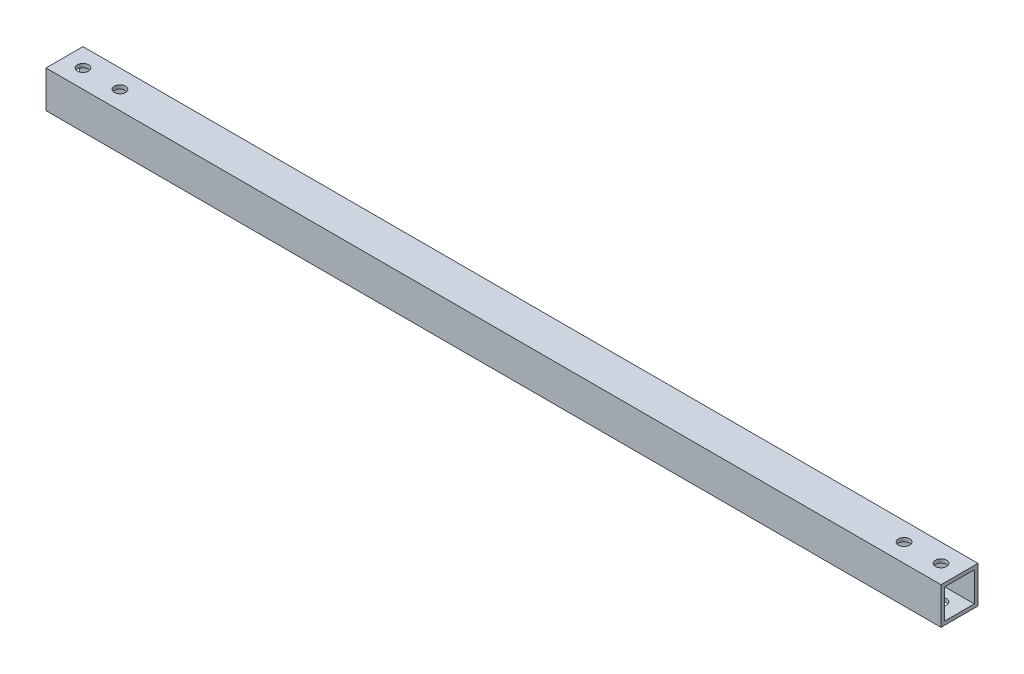
from build123d import *

# Parameters (mm, degrees)
SKETCH1_W           = 20
SKETCH1_H           = 20
SKETCH1_W_2         = 16
SKETCH1_H_2         = 16
BOSS_EXTRUDE1_DEPTH = 242
SKETCH2_R           = 3
CUT_EXTRUDE1_DEPTH  = 244.030862238


with BuildPart() as part:
    # Sketch1 → Boss-Extrude1 (new, symmetric)
    with BuildSketch(Plane(origin=(0, 0, 0), x_dir=(0, 0, -1), z_dir=(1, 0, 0))):
        Rectangle(SKETCH1_W, SKETCH1_H)
        Rectangle(SKETCH1_W_2, SKETCH1_H_2, mode=Mode.SUBTRACT)
    extrude(amount=BOSS_EXTRUDE1_DEPTH, both=True)

    # Sketch2 → Cut-Extrude1 (cut, through all)
    with BuildSketch(Plane(origin=(0, 10, 0), x_dir=(1, 0, 0), z_dir=(0, 1, 0))):
        with Locations(Location((212, 0, 0), (0, 0, 270))):
            Circle(SKETCH2_R)
        with Locations(Location((232, 0, 0), (0, 0, 270))):
            Circle(SKETCH2_R)
        with Locations(Location((-232, 0, 0), (0, 0, 270))):
            Circle(SKETCH2_R)
        with Locations(Location((-212, 0, 0), (0, 0, 270))):
            Circle(SKETCH2_R)
    extrude(amount=-CUT_EXTRUDE1_DEPTH, mode=Mode.SUBTRACT)


solid = part.part
